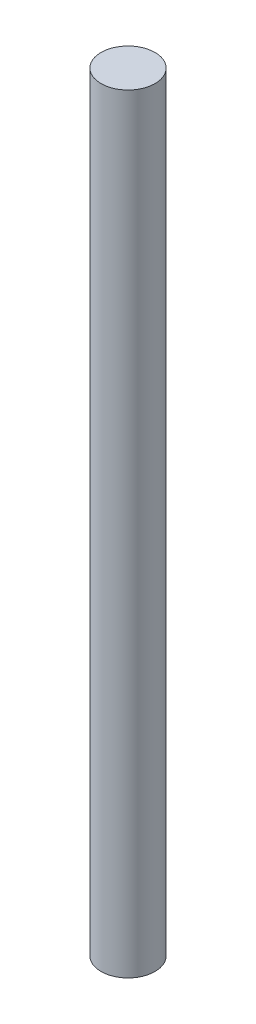
from build123d import *

# Parameters (mm, degrees)
SKETCH_1_R      = 1
EXTRUDE_1_DEPTH = 28.5


with BuildPart() as part:
    # ｽｹｯﾁ1 → ﾎﾞｽ - 押し出し1 (new body)
    with BuildSketch(Plane(origin=(0, 0, 0), x_dir=(1, 0, 0), z_dir=(0, 1, 0))):
        with Locations(Location((0, 0, 0), (0, 0, 90))):
            Circle(SKETCH_1_R)
    extrude(amount=EXTRUDE_1_DEPTH)


solid = part.part
